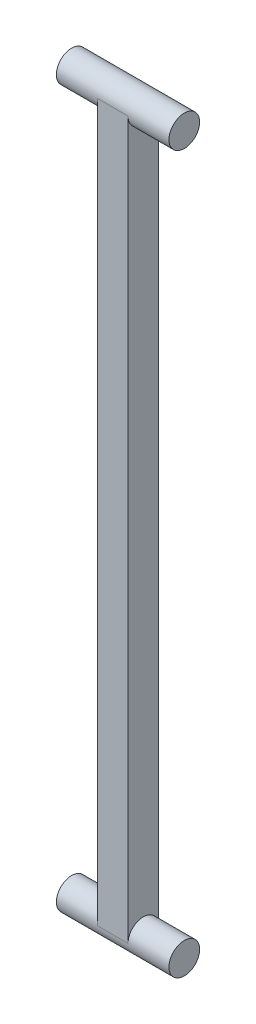
from build123d import *

# Parameters (mm, degrees)
SKETCH1_W                = 30
SKETCH1_H                = 350
BOSS_EXTRUDE1_DEPTH      = 30
BOSS_EXTRUDE2_DEPTH      = 40
BOSS_EXTRUDE2_DEPTH_BACK = 70
SKETCH2_R                = 15


with BuildPart() as part:
    # Sketch1 → Boss-Extrude1 (new body)
    with BuildSketch(Plane.XY):
        Rectangle(SKETCH1_W, SKETCH1_H)
    extrude(amount=BOSS_EXTRUDE1_DEPTH)

    # Sketch2 → Boss-Extrude2 (add, two sides: drawn at the far end of the back side and taken through both)
    with BuildSketch(Plane(origin=(15, 0, 0), x_dir=(0, 0, -1), z_dir=(1, 0, 0)).offset(-BOSS_EXTRUDE2_DEPTH_BACK)):
        with Locations(Location((-15, -175, 0), (0, 0, 90))):
            Circle(SKETCH2_R)
    extrude(amount=BOSS_EXTRUDE2_DEPTH + BOSS_EXTRUDE2_DEPTH_BACK)

    # Mirror1: part across plane


with BuildPart() as part_1:
    add(part.part)
    add(part.part.mirror(Plane(origin=(-15, 175, 30), x_dir=(0, 0, 1), z_dir=(0, -1, 0))))


solid = part_1.part
